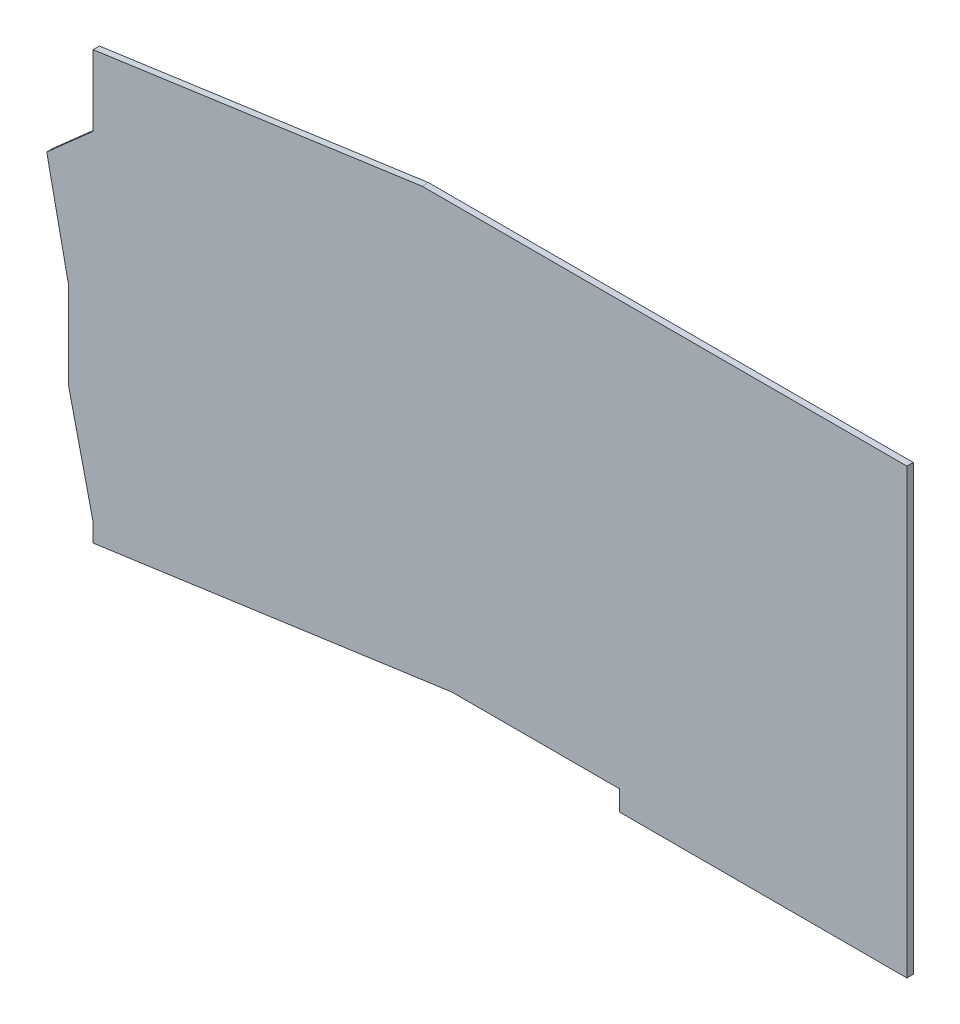
from build123d import *

# Parameters (mm, degrees)
BOSS_EXTRUDE1_DEPTH = 1.5


with BuildPart() as part:
    # Sketch1 → Boss-Extrude1 (new body)
    with BuildSketch(Plane.XY):
        Polygon((134.062572146, 32.923601974), (134.062572146, 12.300802869), (139.839489186, -12.591792214), (139.839489186, -16.928223482), (224.774174162, -5), (264.483473527, -5), (264.483473527, -9.762174065), (332.522866793, -9.762174065), (332.522866793, 95.194195075), (217.724335712, 95.194195075), (139.839489186, 84.247730748), (139.839489186, 67.500140575), (128.863446306, 57.778560046), align=None)
    extrude(amount=BOSS_EXTRUDE1_DEPTH)


solid = part.part
